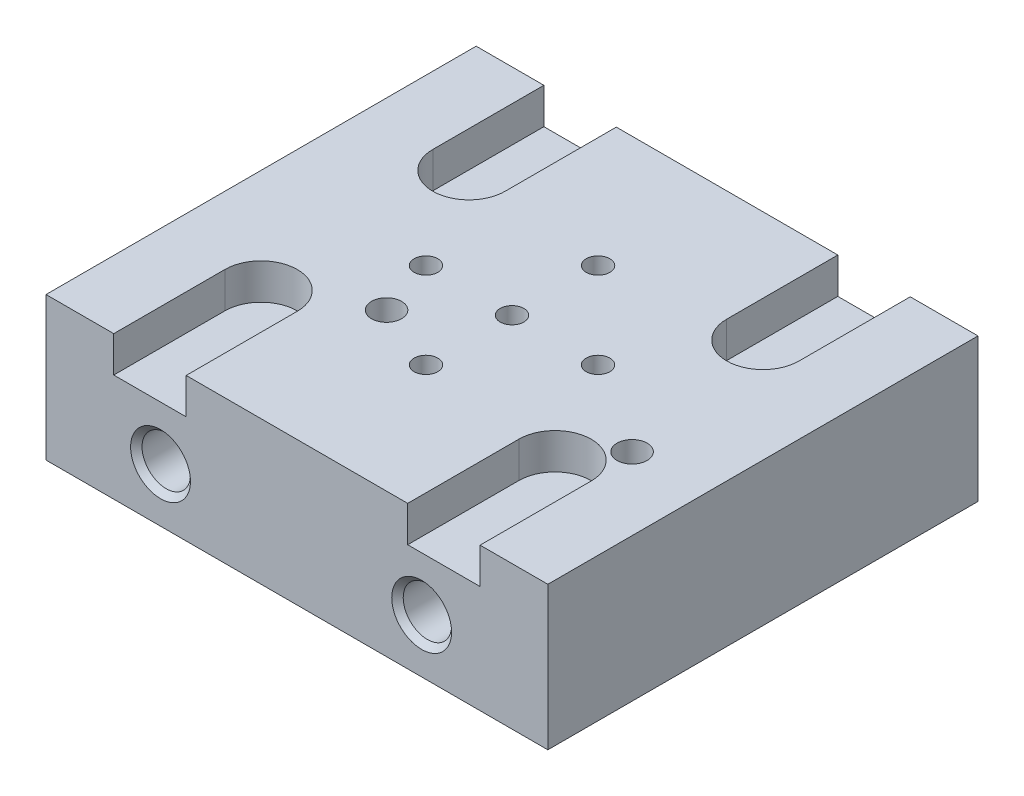
from build123d import *

# Parameters (mm, degrees)
SKETCH3_W           = 70
SKETCH3_H           = 60
BOSS_EXTRUDE3_DEPTH = 20
SKETCH4_R           = 1.65
CUT_EXTRUDE1_DEPTH  = 95.339811321
SKETCH6_R           = 2.1
CUT_EXTRUDE2_DEPTH  = 95.339811321
SKETCH9_R           = 3.375
CUT_EXTRUDE3_DEPTH  = 40.25
CUT_EXTRUDE4_START  = -3
SKETCH11_R          = 3
SKETCH11_R_2        = 1.65
CUT_EXTRUDE4_DEPTH  = 3
CUT_EXTRUDE5_DEPTH  = 5
CHAMFER2_SIZE       = 0.8


with BuildPart() as part:
    # Sketch3 → Boss-Extrude3 (new body)
    with BuildSketch(Plane(origin=(0, 0, 0), x_dir=(1, 0, 0), z_dir=(0, 1, 0))):
        with Locations((35, -30)):
            Rectangle(SKETCH3_W, SKETCH3_H)
    extrude(amount=BOSS_EXTRUDE3_DEPTH)

    # Sketch4 → Cut-Extrude1 (cut, through all)
    with BuildSketch(Plane(origin=(0, 20, 0), x_dir=(1, 0, 0), z_dir=(0, 1, 0))):
        with Locations(Location((35, -30, 0), (0, 0, 270))):
            Circle(SKETCH4_R)
        with Locations(Location((35, -18, 0), (0, 0, 270))):
            Circle(SKETCH4_R)
        with Locations(Location((47, -30, 0), (0, 0, 270))):
            Circle(SKETCH4_R)
        with Locations(Location((35, -42, 0), (0, 0, 270))):
            Circle(SKETCH4_R)
        with Locations(Location((23, -30, 0), (0, 0, 270))):
            Circle(SKETCH4_R)
    extrude(amount=-CUT_EXTRUDE1_DEPTH, mode=Mode.SUBTRACT)

    # Sketch6 → Cut-Extrude2 (cut, through all)
    with BuildSketch(Plane.XZ):
        with Locations(Location((25.625, 38.125, 0), (0, 0, 270))):
            Circle(SKETCH6_R)
        with Locations(Location((59.875, 38.125, 0), (0, 0, 270))):
            Circle(SKETCH6_R)
    extrude(amount=-CUT_EXTRUDE2_DEPTH, mode=Mode.SUBTRACT)

    # Sketch9 → Cut-Extrude3 (cut)
    with BuildSketch(Plane(origin=(0, 0, 60), x_dir=(-1, 0, 0), z_dir=(0, 0, -1))):
        with Locations((-52.4, 7.5)):
            Circle(SKETCH9_R)
        with Locations((-15.975, 7.5)):
            Circle(SKETCH9_R)
    extrude(amount=CUT_EXTRUDE3_DEPTH, mode=Mode.SUBTRACT)

    # Sketch11 → Cut-Extrude4 (cut)
    # profile 1 of 10: a face of its own
    with BuildSketch(Plane.XZ.offset(CUT_EXTRUDE4_START)):
        with Locations(Location((35, 18, 0), (0, 0, 270))):
            Circle(SKETCH11_R)
        with Locations(Location((35, 18, 0), (0, 0, 90))):
            Circle(SKETCH11_R_2, mode=Mode.SUBTRACT)
    # profile 2 of 10: a face of its own
    with BuildSketch(Plane.XZ.offset(CUT_EXTRUDE4_START)):
        with Locations(Location((35, 30, 0), (0, 0, 270))):
            Circle(SKETCH11_R)
        with Locations(Location((35, 30, 0), (0, 0, 90))):
            Circle(SKETCH11_R_2, mode=Mode.SUBTRACT)
    # profile 3 of 10: a face of its own
    with BuildSketch(Plane.XZ.offset(CUT_EXTRUDE4_START)):
        with Locations(Location((47, 30, 0), (0, 0, 270))):
            Circle(SKETCH11_R)
        with Locations(Location((47, 30, 0), (0, 0, 90))):
            Circle(SKETCH11_R_2, mode=Mode.SUBTRACT)
    # profile 4 of 10: a face of its own
    with BuildSketch(Plane.XZ.offset(CUT_EXTRUDE4_START)):
        with Locations(Location((23, 30, 0), (0, 0, 270))):
            Circle(SKETCH11_R)
        with Locations(Location((23, 30, 0), (0, 0, 90))):
            Circle(SKETCH11_R_2, mode=Mode.SUBTRACT)
    # profile 5 of 10: a face of its own
    with BuildSketch(Plane.XZ.offset(CUT_EXTRUDE4_START)):
        with Locations(Location((35, 42, 0), (0, 0, 270))):
            Circle(SKETCH11_R)
        with Locations(Location((35, 42, 0), (0, 0, 90))):
            Circle(SKETCH11_R_2, mode=Mode.SUBTRACT)
    # profile 6 of 10: a face of its own
    with BuildSketch(Plane.XZ.offset(CUT_EXTRUDE4_START)):
        with Locations(Location((35, 42, 0), (0, 0, 90))):
            Circle(SKETCH11_R_2)
    # profile 7 of 10: a face of its own
    with BuildSketch(Plane.XZ.offset(CUT_EXTRUDE4_START)):
        with Locations(Location((23, 30, 0), (0, 0, 90))):
            Circle(SKETCH11_R_2)
    # profile 8 of 10: a face of its own
    with BuildSketch(Plane.XZ.offset(CUT_EXTRUDE4_START)):
        with Locations(Location((35, 30, 0), (0, 0, 90))):
            Circle(SKETCH11_R_2)
    # profile 9 of 10: a face of its own
    with BuildSketch(Plane.XZ.offset(CUT_EXTRUDE4_START)):
        with Locations(Location((47, 30, 0), (0, 0, 90))):
            Circle(SKETCH11_R_2)
    # profile 10 of 10: a face of its own
    with BuildSketch(Plane.XZ.offset(CUT_EXTRUDE4_START)):
        with Locations(Location((35, 18, 0), (0, 0, 90))):
            Circle(SKETCH11_R_2)
    extrude(amount=CUT_EXTRUDE4_DEPTH, mode=Mode.SUBTRACT)

    # Sketch12 → Cut-Extrude5 (cut)
    with BuildSketch(Plane(origin=(0, 20, 0), x_dir=(1, 0, 0), z_dir=(0, 1, 0))):
        with BuildLine():
            Line((9.45, -60.104949747), (9.45, -44.5))
            ThreePointArc((9.45, -44.5), (14.5, -39.45), (19.55, -44.5))
            Line((19.55, -44.5), (19.55, -60.104949747))
            ThreePointArc((19.55, -60.104949747), (14.5, -65.154949747), (9.45, -60.104949747))
        make_face()
        with BuildLine():
            Line((60.55, -60.104949747), (60.55, -44.5))
            ThreePointArc((60.55, -44.5), (55.5, -39.45), (50.45, -44.5))
            Line((50.45, -44.5), (50.45, -60.104949747))
            ThreePointArc((50.45, -60.104949747), (55.5, -65.154949747), (60.55, -60.104949747))
        make_face()
        with BuildLine():
            Line((60.55, 0.104949747), (60.55, -15.5))
            ThreePointArc((60.55, -15.5), (55.5, -20.55), (50.45, -15.5))
            Line((50.45, -15.5), (50.45, 0.104949747))
            ThreePointArc((50.45, 0.104949747), (55.5, 5.154949747), (60.55, 0.104949747))
        make_face()
        with BuildLine():
            Line((9.45, 0.104949747), (9.45, -15.5))
            ThreePointArc((9.45, -15.5), (14.5, -20.55), (19.55, -15.5))
            Line((19.55, -15.5), (19.55, 0.104949747))
            ThreePointArc((19.55, 0.104949747), (14.5, 5.154949747), (9.45, 0.104949747))
        make_face()
    extrude(amount=-CUT_EXTRUDE5_DEPTH, mode=Mode.SUBTRACT)

    # Chamfer2
    chamfer2_edges = [part.edges().sort_by_distance(p)[0] for p in [
        (55.775, 7.5, 60),
        (19.35, 7.5, 60),
    ]]
    chamfer(chamfer2_edges, length=CHAMFER2_SIZE)


solid = part.part
